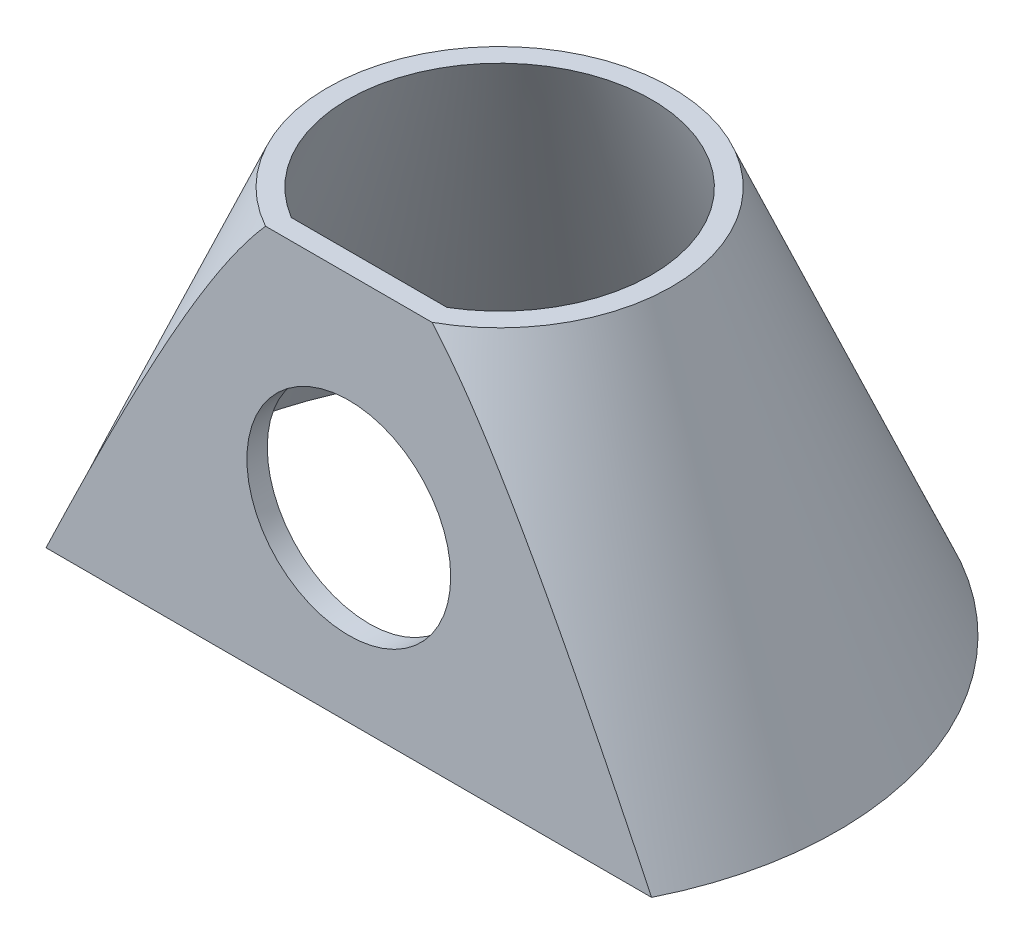
from build123d import *

# Parameters (mm, degrees)
CUT_EXTRUDE1_DEPTH      = 32.981303132
CUT_EXTRUDE1_DEPTH_BACK = 32.981303132
SKETCH4_W               = 44.770884432
SKETCH4_H               = 10.69042287
SKETCH6_W               = 30.665330586
SKETCH6_H               = 1
BOSS_EXTRUDE1_DEPTH     = 21.05
SKETCH8_W               = 44.013591964
SKETCH8_H               = 26.255140404
CUT_EXTRUDE2_DEPTH      = 1
SKETCH9_W               = 50.816359418
SKETCH9_H               = 30.548951937
CUT_EXTRUDE3_DEPTH      = 1
CUT_EXTRUDE4_REACH      = 35.955
SKETCH10_R              = 5


with BuildPart() as part:
    # Sketch3 → Revolve1 (revolve)
    with BuildSketch(Plane.XY):
        Polygon((-7.025, 18.366712654), (-8.025, 18.366712654), (-17.025, -2.683287346), (-16.025, -2.683287346), align=None)
    revolve(axis=Axis((0, 50, 0), (0, -1, 0)))

    # Sketch4 → Cut-Extrude1 (cut, two sides: drawn at the far end of the back side and taken through both)
    with BuildSketch(Plane(origin=(0, 18.366712654, 0), x_dir=(1, 0, 0), z_dir=(0, 1, 0)).offset(-CUT_EXTRUDE1_DEPTH_BACK)):
        with Locations((0.720276718, -12.745211435)):
            Rectangle(SKETCH4_W, SKETCH4_H)
    extrude(amount=CUT_EXTRUDE1_DEPTH + CUT_EXTRUDE1_DEPTH_BACK, mode=Mode.SUBTRACT)

    # Sketch6 → Boss-Extrude1 (add)
    with BuildSketch(Plane.XZ.offset(2.683287346)):
        with Locations((0, 6.9)):
            Rectangle(SKETCH6_W, SKETCH6_H)
    extrude(amount=-BOSS_EXTRUDE1_DEPTH)

    # Sketch7 → Cut-Revolve1 (revolve, cut)
    with BuildSketch(Plane(origin=(0, 0, 0), x_dir=(0, 0, -1), z_dir=(1, 0, 0))):
        Polygon((8.025, 18.366712654), (17.025, -2.683287346), (18.600289965, -2.683287346), (18.600289965, 18.366712654), align=None)
    revolve(axis=Axis((0, 14.930838331, 0), (0, -1, 0)), mode=Mode.SUBTRACT)

    # Sketch8 → Cut-Extrude2 (cut)
    with BuildSketch(Plane(origin=(0, 18.366712654, 0), x_dir=(1, 0, 0), z_dir=(0, 1, 0))):
        with Locations((-2.588663139, 4.329260992)):
            Rectangle(SKETCH8_W, SKETCH8_H)
    extrude(amount=-CUT_EXTRUDE2_DEPTH, mode=Mode.SUBTRACT)

    # Sketch9 → Cut-Extrude3 (cut)
    with BuildSketch(Plane.XZ.offset(2.683287346)):
        with Locations((0.819476292, -3.706436551)):
            Rectangle(SKETCH9_W, SKETCH9_H)
    extrude(amount=-CUT_EXTRUDE3_DEPTH, mode=Mode.SUBTRACT)

    # Sketch10 → Cut-Extrude4 (cut, up to next)
    with BuildSketch(Plane.XY.offset(7.4), mode=Mode.PRIVATE) as cut_extrude4_sk1:
        with Locations((0, 7.016712654)):
            Circle(SKETCH10_R)
    cut_extrude4_tool1 = extrude(cut_extrude4_sk1.sketch, amount=-CUT_EXTRUDE4_REACH, mode=Mode.PRIVATE) & part.part
    add(cut_extrude4_tool1.solids().sort_by_distance((0, 7.016713, 7.4))[0], mode=Mode.SUBTRACT)


solid = part.part
